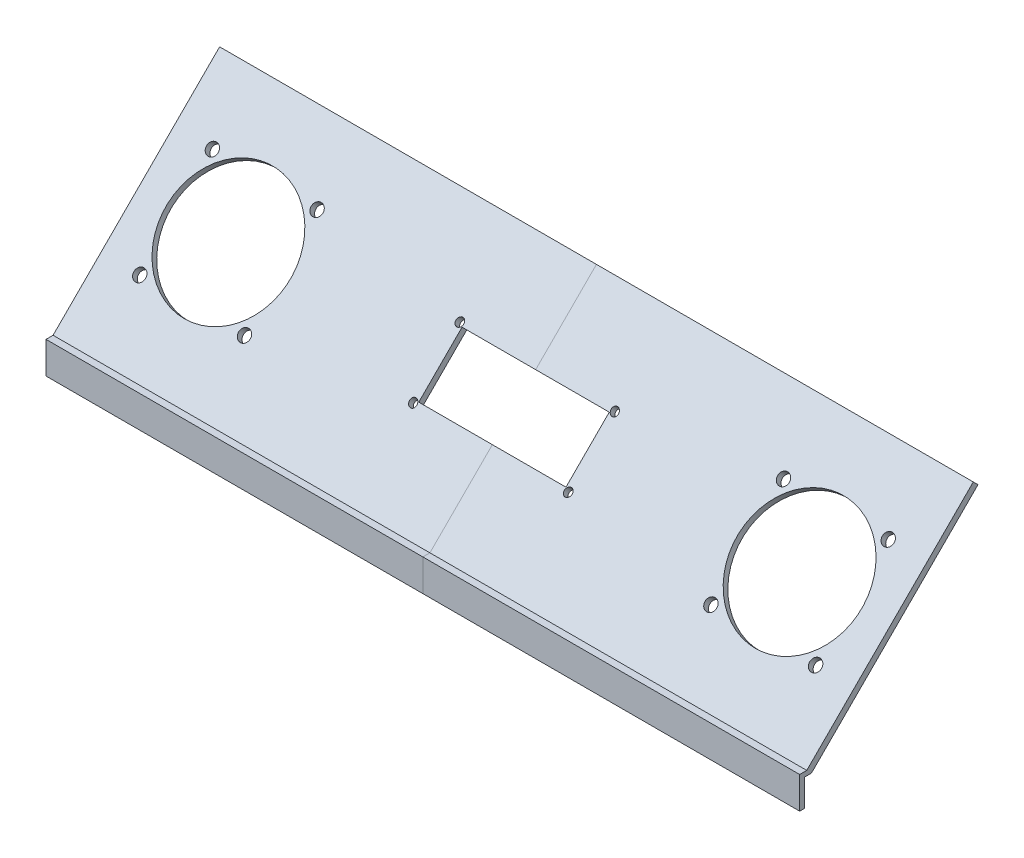
from build123d import *

# Parameters (mm, degrees)
BOSS_EXTRUDE1_DEPTH = 160
BOSS_EXTRUDE2_DEPTH = 160
SKETCH4_W           = 31.25
SKETCH4_H           = 13.5
SKETCH4_H_2         = 12.5
CUT_EXTRUDE1_DEPTH  = 10
SKETCH5_RX          = 1.746988937
SKETCH5_RY          = 1.595946068
CUT_EXTRUDE2_DEPTH  = 10
SKETCH6_R           = 26.5
CUT_EXTRUDE3_DEPTH  = 10
SKETCH7_R           = 2.5
CUT_EXTRUDE4_DEPTH  = 10


with BuildPart() as part:
    # Sketch1 → Boss-Extrude1 (new body)
    with BuildSketch(Plane(origin=(0, 0, 0), x_dir=(0, 0, -1), z_dir=(1, 0, 0))):
        Polygon((0, 0), (0, 11.5), (3, 11.5), (3, 13.5), (-2, 13.5), (-2, 0), align=None)
    extrude(amount=BOSS_EXTRUDE1_DEPTH)

    # Sketch2 → Boss-Extrude2 (add)
    with BuildSketch(Plane(origin=(0, 0, 0), x_dir=(0, 0, -1), z_dir=(1, 0, 0))):
        Polygon((3, 13.5), (3, 11.5), (24.213203436, 32.713203436), (73.710678119, 82.210678119), (71.710678119, 84.210678119), (22.213203436, 34.713203436), (1, 13.5), align=None)
    extrude(amount=BOSS_EXTRUDE2_DEPTH)

    # Sketch4 → Cut-Extrude1 (cut)
    with BuildSketch(Plane(origin=(0, 6.25, 6.25), x_dir=(1, 0, 0), z_dir=(0, 0.7071067811865477, 0.7071067811865475))):
        with Locations((144.375, 67.003048327)):
            Rectangle(SKETCH4_W, SKETCH4_H)
        with Locations((144.375, 54.003048327)):
            Rectangle(SKETCH4_W, SKETCH4_H_2)
    extrude(amount=-CUT_EXTRUDE1_DEPTH, mode=Mode.SUBTRACT)

    # Sketch5 → Cut-Extrude2 (cut)
    with BuildSketch(Plane(origin=(0, 6.25, 6.25), x_dir=(1, 0, 0), z_dir=(0, 0.7071067811865477, 0.7071067811865475))):
        with Locations(Location((127.094534644, 74.747197969), (0, 0, 67.904979496))):
            Ellipse(SKETCH5_RX, SKETCH5_RY)
        with Locations(Location((127.094534644, 46.758898685), (0, 0, -67.904979496))):
            Ellipse(SKETCH5_RX, SKETCH5_RY)
    extrude(amount=-CUT_EXTRUDE2_DEPTH, mode=Mode.SUBTRACT)

    # Sketch6 → Cut-Extrude3 (cut)
    with BuildSketch(Plane(origin=(0, 6.25, 6.25), x_dir=(1, 0, 0), z_dir=(0, 0.7071067811865477, 0.7071067811865475))):
        with Locations(Location((38.75, 60.753048327, 0), (0, 0, 270))):
            Circle(SKETCH6_R)
    extrude(amount=-CUT_EXTRUDE3_DEPTH, mode=Mode.SUBTRACT)

    # Sketch7 → Cut-Extrude4 (cut)
    with BuildSketch(Plane(origin=(0, 6.25, 6.25), x_dir=(1, 0, 0), z_dir=(0, 0.7071067811865477, 0.7071067811865475))):
        with Locations(Location((16.523498497, 82.551969583, 0), (0, 0, 270))):
            Circle(SKETCH7_R)
        with Locations(Location((60.976501503, 82.551969583, 0), (0, 0, 270))):
            Circle(SKETCH7_R)
        with Locations(Location((60.976501503, 38.954127071, 0), (0, 0, 270))):
            Circle(SKETCH7_R)
        with Locations(Location((16.523498497, 38.954127071, 0), (0, 0, 270))):
            Circle(SKETCH7_R)
    extrude(amount=-CUT_EXTRUDE4_DEPTH, mode=Mode.SUBTRACT)

    # Mirror4: part across plane


with BuildPart() as part_1:
    add(part.part)
    add(part.part.mirror(Plane(origin=(160, 0, 0), x_dir=(0, 0, 1), z_dir=(1, 0, 0))))


with BuildPart() as body_2:
    # Split2: the piece on the far side of the plane
    add(part_1.part)
    split(bisect_by=Plane(origin=(160, 0, 0), x_dir=(0, 0, 1), z_dir=(1, 0, 0)), keep=Keep.BOTTOM)


with BuildPart() as part_2:
    add(part_1.part)

    # Split2
    split(bisect_by=Plane(origin=(160, 0, 0), x_dir=(0, 0, 1), z_dir=(1, 0, 0)), keep=Keep.TOP)


solid = Compound([body_2.part, part_2.part])
